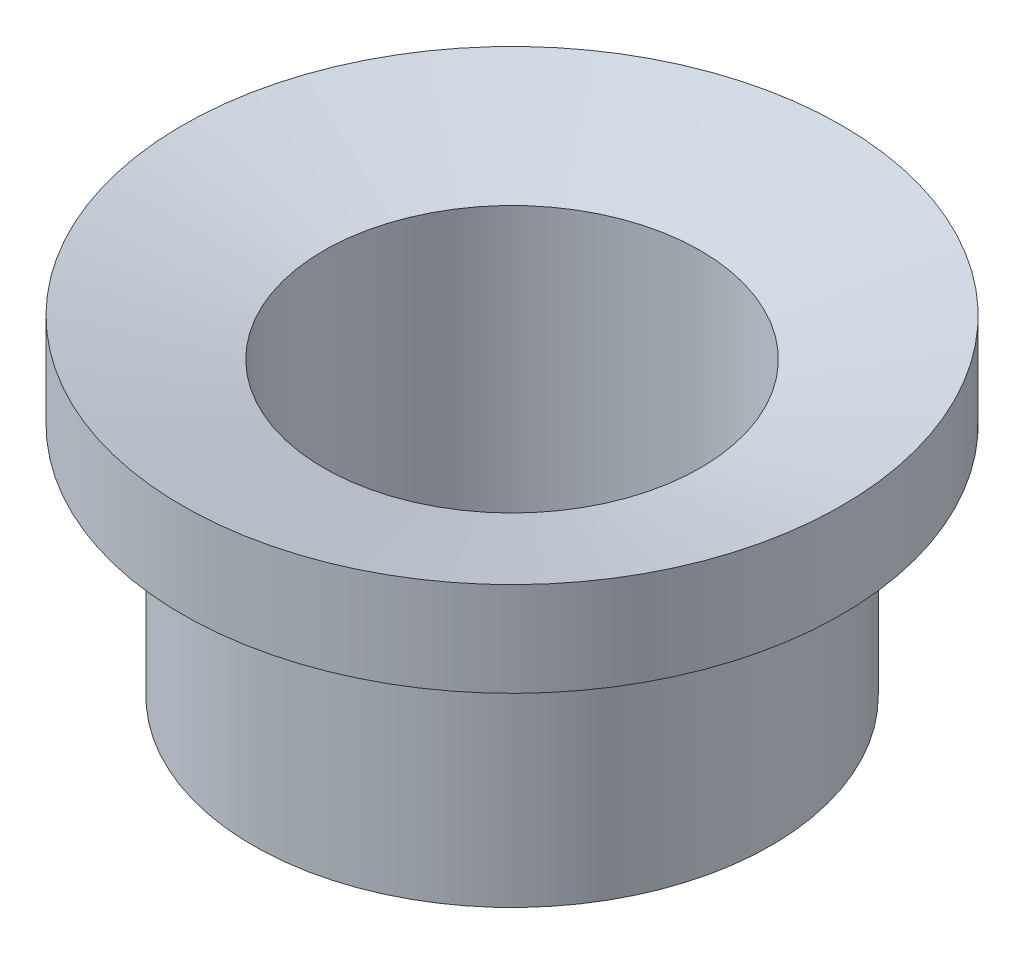
from build123d import *


with BuildPart() as part:
    # Sketch2 → Revolve1 (revolve)
    with BuildSketch(Plane.XY, mode=Mode.PRIVATE) as revolve1_sk:
        Polygon((12, 0), (16.5, 0), (16.5, 15), (21, 15), (21, 21), (12, 18.588457268), align=None)
    revolve(revolve1_sk.sketch.rotate(Axis((0, 0, 0), (0, 1, 0)), 90), axis=Axis((0, 0, 0), (0, 1, 0)))


solid = part.part
